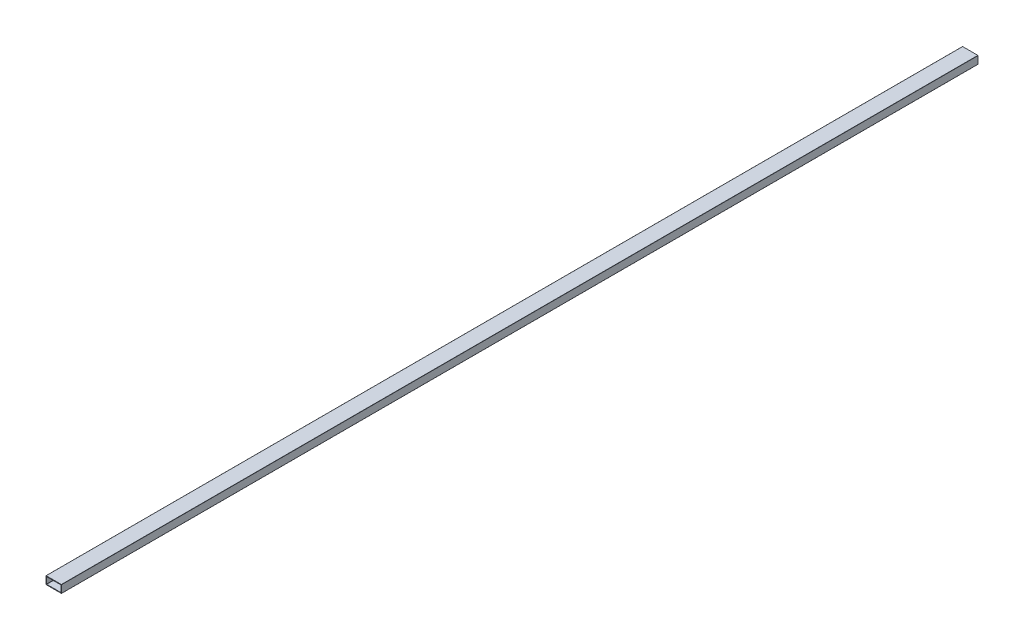
from build123d import *

# Parameters (mm, degrees)
CROQUIS1_W              = 101.6
CROQUIS1_H              = 50.8
CROQUIS1_W_2            = 94
CROQUIS1_H_2            = 43.2
SALIENTE_EXTRUIR1_DEPTH = 6000
REDONDEO1_R             = 1


with BuildPart() as part:
    # Croquis1 → Saliente-Extruir1 (new body)
    with BuildSketch(Plane.XY):
        Rectangle(CROQUIS1_W, CROQUIS1_H)
        Rectangle(CROQUIS1_W_2, CROQUIS1_H_2, mode=Mode.SUBTRACT)
    extrude(amount=-SALIENTE_EXTRUIR1_DEPTH)

    # Redondeo1
    redondeo1_edges = [part.edges().sort_by_distance(p)[0] for p in [
        (47, -21.6, -3000),
        (-47, -21.6, -3000),
        (-47, 21.6, -3000),
        (47, 21.6, -3000),
        (50.8, -25.4, -3000),
        (-50.8, -25.4, -3000),
        (-50.8, 25.4, -3000),
        (50.8, 25.4, -3000),
    ]]
    fillet(redondeo1_edges, radius=REDONDEO1_R)


solid = part.part
